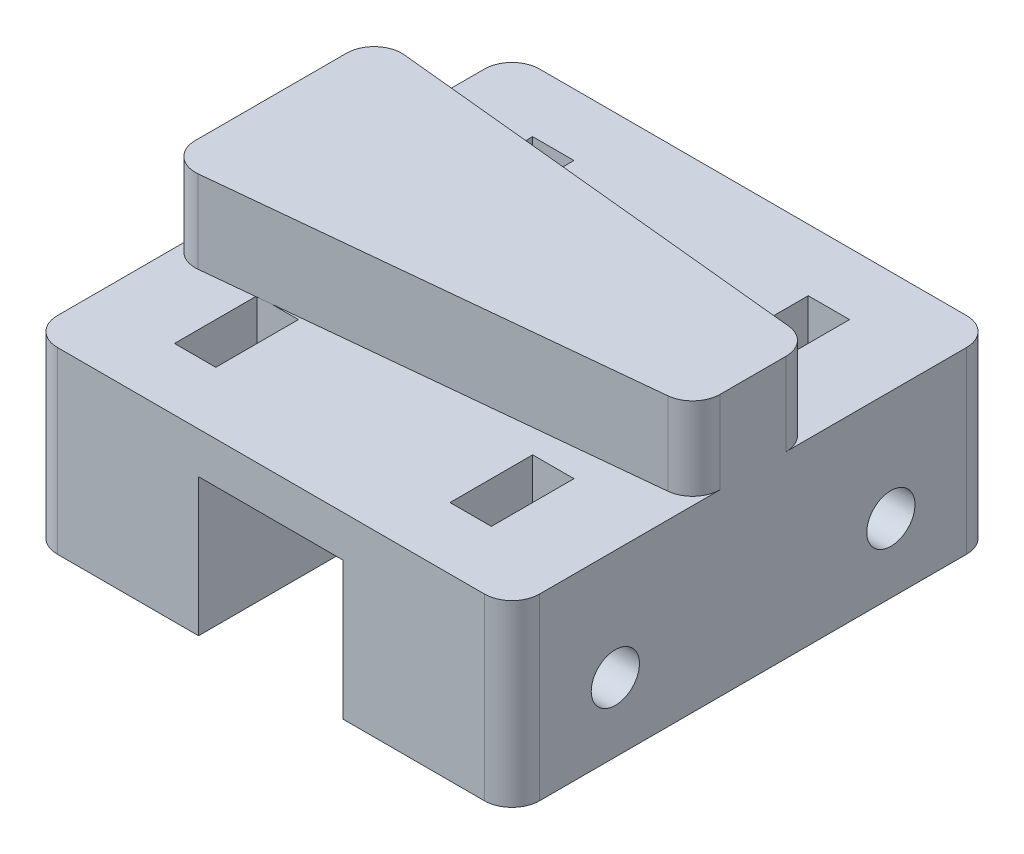
from build123d import *

# Parameters (mm, degrees)
SKETCH_1_W          = 35
SKETCH_1_H          = 35
EXTRUDE_6_DEPTH     = 3
EXTRUDE_7_DEPTH     = 6
SKETCH_6_W          = 12.25
SKETCH_6_H          = 35
EXTRUDE_8_DEPTH     = 10
FILLET_2_R          = 2
SKETCH_7_R          = 1.75
CUT_EXTRUDE_3_DEPTH = 41.388736054
SKETCH_8_W          = 3
SKETCH_8_H          = 6
CUT_EXTRUDE_4_DEPTH = 13
CUT_EXTRUDE_5_DEPTH = 4
SKETCH_12_R         = 1.75
CUT_EXTRUDE_6_DEPTH = 28.726341266


with BuildPart() as part:
    # Эскиз1 → Бобышка-Вытянуть6 (new body)
    with BuildSketch(Plane(origin=(0, 0, 0), x_dir=(1, 0, 0), z_dir=(0, 1, 0))):
        Rectangle(SKETCH_1_W, SKETCH_1_H)
    extrude(amount=EXTRUDE_6_DEPTH)

    # Эскиз5 → Бобышка-Вытянуть7 (add)
    with BuildSketch(Plane(origin=(0, 3, 0), x_dir=(1, 0, 0), z_dir=(0, 1, 0))):
        Polygon((-17.5, 7.700997512), (-17.5, 7.5), (-17.5, -7.5), (-17.5, -7.700997512), (17.5, -4.200997512), (17.5, -4), (17.5, 4), (17.5, 4.200997512), align=None)
    extrude(amount=EXTRUDE_7_DEPTH)

    # Эскиз6 → Бобышка-Вытянуть8 (add)
    with BuildSketch(Plane.XZ):
        with Locations((-11.375, 0)):
            Rectangle(SKETCH_6_W, SKETCH_6_H)
        with Locations((11.375, 0)):
            Rectangle(SKETCH_6_W, SKETCH_6_H)
    extrude(amount=EXTRUDE_8_DEPTH)

    # Скругление2
    fillet_2_edges = [part.edges().sort_by_distance(p)[0] for p in [
        (17.5, 6, 4.200997512),
        (17.5, 6, -4.200997512),
        (-17.5, 6, -7.700997512),
        (-17.5, 6, 7.700997512),
        (-17.5, -3.5, 17.5),
        (17.5, -3.5, 17.5),
        (17.5, -3.5, -17.5),
        (-17.5, -3.5, -17.5),
    ]]
    fillet(fillet_2_edges, radius=FILLET_2_R)

    # Эскиз7 → Вырез-Вытянуть3 (cut, through all)
    with BuildSketch(Plane.ZY.offset(17.5)):
        with Locations((-10, -5)):
            Circle(SKETCH_7_R)
        with Locations((10, -5)):
            Circle(SKETCH_7_R)
    extrude(amount=-CUT_EXTRUDE_3_DEPTH, mode=Mode.SUBTRACT)

    # Эскиз8 → Вырез-Вытянуть4 (cut)
    with BuildSketch(Plane.XZ.offset(10)):
        with Locations((-10, -10)):
            Rectangle(SKETCH_8_W, SKETCH_8_H)
        with Locations((10, -10)):
            Rectangle(SKETCH_8_W, SKETCH_8_H)
        with Locations((-10, 10)):
            Rectangle(SKETCH_8_W, SKETCH_8_H)
        with Locations((10, 10)):
            Rectangle(SKETCH_8_W, SKETCH_8_H)
    extrude(amount=-CUT_EXTRUDE_4_DEPTH, mode=Mode.SUBTRACT)

    # Эскиз11 → Вырез-Вытянуть5 (cut)
    with BuildSketch(Plane(origin=(0, 6.5, 0), x_dir=(1, 0, 0), z_dir=(0, 1, 0))):
        Polygon((-8.267949192, -3), (-6.535898385, 0), (-8.267949192, 3), (-11.732050808, 3), (-13.464101615, 0), (-11.732050808, -3), align=None)
        Polygon((6.535898385, 0), (8.267949192, -3), (11.732050808, -3), (13.464101615, 0), (11.732050808, 3), (8.267949192, 3), align=None)
    extrude(amount=-CUT_EXTRUDE_5_DEPTH, mode=Mode.SUBTRACT)

    # Эскиз12 → Вырез-Вытянуть6 (cut, through all)
    with BuildSketch(Plane(origin=(0, 2.5, 0), x_dir=(1, 0, 0), z_dir=(0, 1, 0))):
        with Locations(Location((-10, 0, 0), (0, 0, 270))):
            Circle(SKETCH_12_R)
        with Locations(Location((10, 0, 0), (0, 0, 270))):
            Circle(SKETCH_12_R)
    extrude(amount=-CUT_EXTRUDE_6_DEPTH, mode=Mode.SUBTRACT)


solid = part.part
